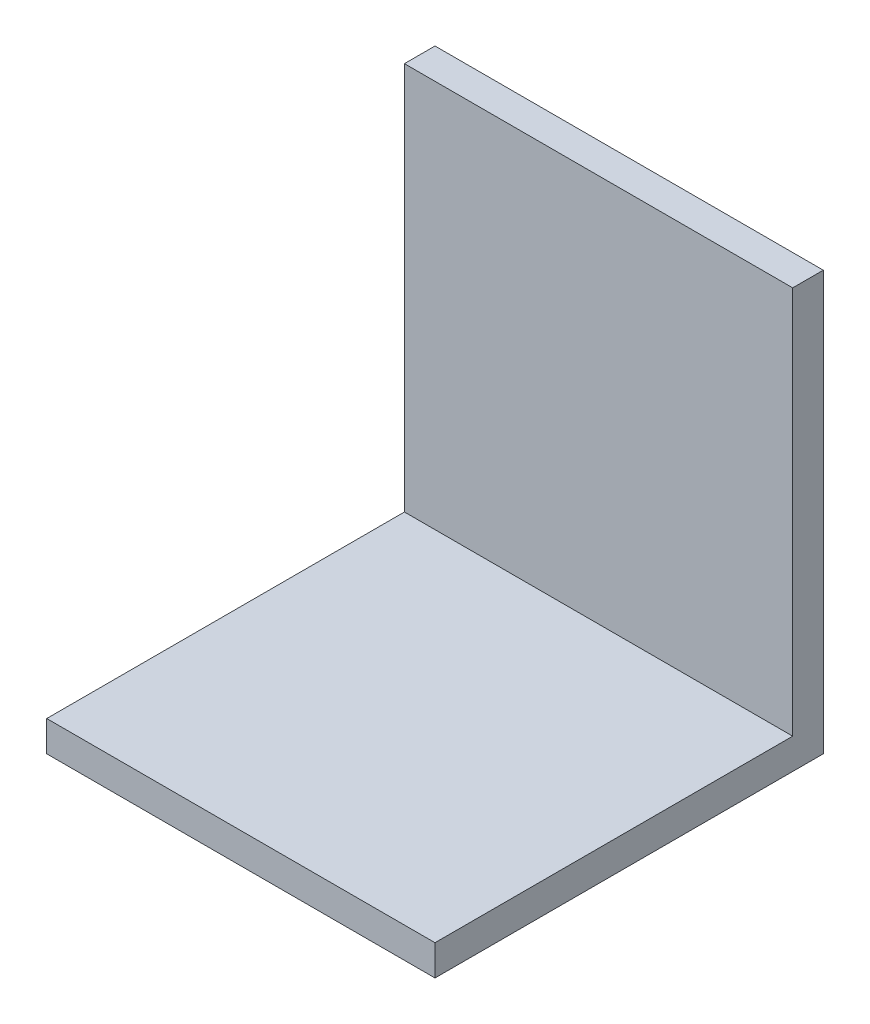
from build123d import *

# Parameters (mm, degrees)
SKETCH_4_W      = 25.4
SKETCH_4_H      = 25.4
EXTRUDE_2_DEPTH = 2
SKETCH_5_W      = 25.4
SKETCH_5_H      = 2
EXTRUDE_3_DEPTH = 2
SKETCH_6_W      = 25.4
SKETCH_6_H      = 2
EXTRUDE_4_DEPTH = 25.4


with BuildPart() as part:
    # 草图4 → 凸台-拉伸2 (new body)
    with BuildSketch(Plane(origin=(0, 0, 0), x_dir=(1, 0, 0), z_dir=(0, 1, 0))):
        with Locations((-13.247410317, -2.685210053)):
            Rectangle(SKETCH_4_W, SKETCH_4_H)
    extrude(amount=EXTRUDE_2_DEPTH)

    # 草图5 → 凸台-拉伸3 (add)
    with BuildSketch(Plane(origin=(-25.947410317, 2, 15.385210053), x_dir=(0, 0, -1), z_dir=(1, 0, 0))):
        with Locations((12.7, -1)):
            Rectangle(SKETCH_5_W, SKETCH_5_H)
    extrude(amount=EXTRUDE_3_DEPTH)

    # 草图6 → 凸台-拉伸4 (add)
    with BuildSketch(Plane(origin=(0, 2, 0), x_dir=(1, 0, 0), z_dir=(0, 1, 0))):
        with Locations((-13.247410317, 9.014789947)):
            Rectangle(SKETCH_6_W, SKETCH_6_H)
    extrude(amount=EXTRUDE_4_DEPTH)


solid = part.part
